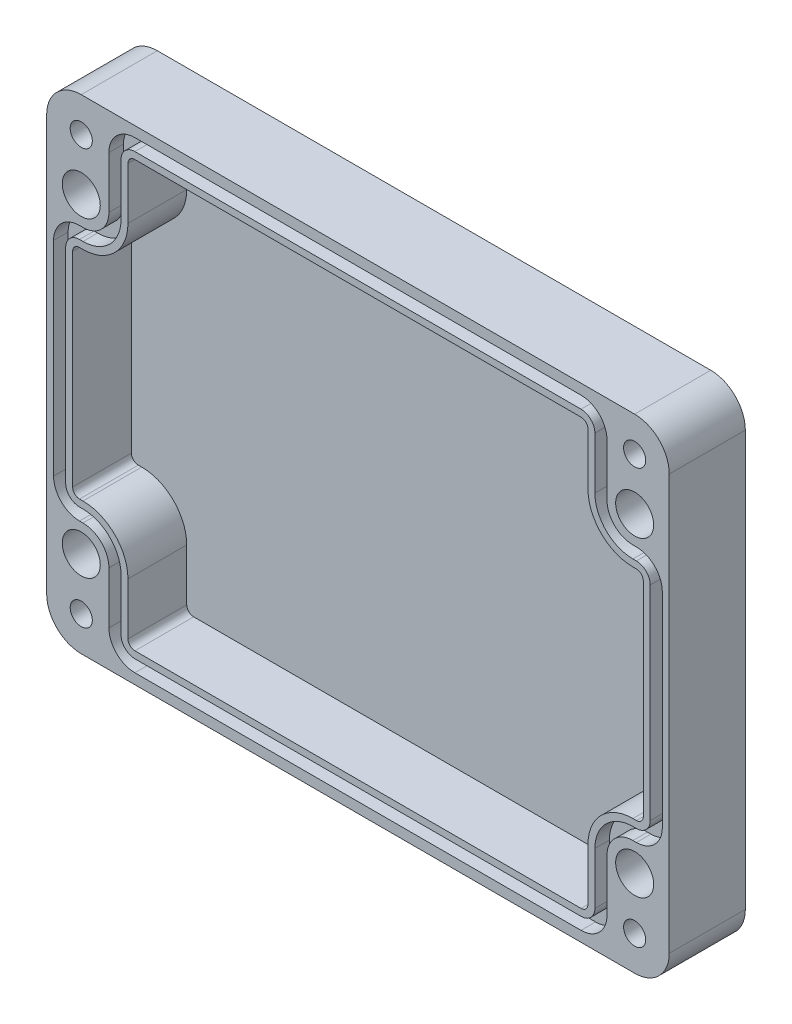
from build123d import *

# Parameters (mm, degrees)
SKETCH1_W                  = 180
SKETCH1_H                  = 140
BOSS_EXTRUDE1_DEPTH        = 22
CUT_EXTRUDE1_DEPTH         = 17
FILLET1_R                  = 2
FILLET2_R                  = 13
CUT_EXTRUDE2_DEPTH         = 4.2
FILLET3_R                  = 10
F_11_0_11_DIAMETER_HOLE1_D = 11
M6_CLEARANCE_HOLE1_D       = 6.4
SKETCH11_R                 = 5.5
CUT_EXTRUDE6_DEPTH         = 7


with BuildPart() as part:
    # Sketch1 → Boss-Extrude1 (new body)
    with BuildSketch(Plane.XY):
        Rectangle(SKETCH1_W, SKETCH1_H)
    extrude(amount=BOSS_EXTRUDE1_DEPTH)

    # Sketch2 → Cut-Extrude1 (cut)
    with BuildSketch(Plane.XY.offset(22)):
        Polygon((-66.5, 61.5), (66.5, 61.5), (66.5, 31.5), (82.5, 31.5), (82.5, -31.5), (66.5, -31.5), (66.5, -61.5), (-66.5, -61.5), (-66.5, -31.5), (-82.5, -31.5), (-82.5, 31.5), (-66.5, 31.5), align=None)
    extrude(amount=-CUT_EXTRUDE1_DEPTH, mode=Mode.SUBTRACT)

    # Fillet1
    fillet1_edges = [part.edges().sort_by_distance(p)[0] for p in [
        (-66.5, 61.5, 13.5),
        (66.5, 61.5, 13.5),
        (82.5, 31.5, 13.5),
        (82.5, -31.5, 13.5),
        (66.5, -61.5, 13.5),
        (-66.5, -61.5, 13.5),
        (-82.5, -31.5, 13.5),
        (-82.5, 31.5, 13.5),
    ]]
    fillet(fillet1_edges, radius=FILLET1_R)

    # Fillet2
    fillet2_edges = [part.edges().sort_by_distance(p)[0] for p in [
        (-66.5, 31.5, 13.5),
        (66.5, 31.5, 13.5),
        (66.5, -31.5, 13.5),
        (-66.5, -31.5, 13.5),
    ]]
    fillet(fillet2_edges, radius=FILLET2_R)

    # Sketch3 → Cut-Extrude2 (cut)
    with BuildSketch(Plane.XY.offset(22)):
        with BuildLine():
            Line((-72, 59.5), (-72, 44.5))
            ThreePointArc((-72, 44.5), (-74.196699141, 39.196699141), (-79.5, 37))
            Line((-79.5, 37), (-80.5, 37))
            ThreePointArc((-80.5, 37), (-85.803300859, 34.803300859), (-88, 29.5))
            Line((-88, 29.5), (-88, -29.5))
            ThreePointArc((-88, -29.5), (-85.803300859, -34.803300859), (-80.5, -37))
            Line((-80.5, -37), (-79.5, -37))
            ThreePointArc((-79.5, -37), (-74.196699141, -39.196699141), (-72, -44.5))
            Line((-72, -44.5), (-72, -59.5))
            ThreePointArc((-72, -59.5), (-69.803300859, -64.803300859), (-64.5, -67))
            Line((-64.5, -67), (64.5, -67))
            ThreePointArc((64.5, -67), (69.803300859, -64.803300859), (72, -59.5))
            Line((72, -59.5), (72, -44.5))
            ThreePointArc((72, -44.5), (74.196699141, -39.196699141), (79.5, -37))
            Line((79.5, -37), (80.5, -37))
            ThreePointArc((80.5, -37), (85.803300859, -34.803300859), (88, -29.5))
            Line((88, -29.5), (88, 29.5))
            ThreePointArc((88, 29.5), (85.803300859, 34.803300859), (80.5, 37))
            Line((80.5, 37), (79.5, 37))
            ThreePointArc((79.5, 37), (74.196699141, 39.196699141), (72, 44.5))
            Line((72, 44.5), (72, 59.5))
            ThreePointArc((72, 59.5), (69.803300859, 64.803300859), (64.5, 67))
            Line((64.5, 67), (-64.5, 67))
            ThreePointArc((-64.5, 67), (-69.803300859, 64.803300859), (-72, 59.5))
        make_face()
        with BuildLine():
            Line((-80.5, -33.5), (-79.5, -33.5))
            ThreePointArc((-79.5, -33.5), (-71.721825407, -36.721825407), (-68.5, -44.5))
            Line((-68.5, -44.5), (-68.5, -59.5))
            ThreePointArc((-68.5, -59.5), (-67.328427125, -62.328427125), (-64.5, -63.5))
            Line((-64.5, -63.5), (64.5, -63.5))
            ThreePointArc((64.5, -63.5), (67.328427125, -62.328427125), (68.5, -59.5))
            Line((68.5, -59.5), (68.5, -44.5))
            ThreePointArc((68.5, -44.5), (71.721825407, -36.721825407), (79.5, -33.5))
            Line((79.5, -33.5), (80.5, -33.5))
            ThreePointArc((80.5, -33.5), (83.328427125, -32.328427125), (84.5, -29.5))
            Line((84.5, -29.5), (84.5, 29.5))
            ThreePointArc((84.5, 29.5), (83.328427125, 32.328427125), (80.5, 33.5))
            Line((80.5, 33.5), (79.5, 33.5))
            ThreePointArc((79.5, 33.5), (71.721825407, 36.721825407), (68.5, 44.5))
            Line((68.5, 44.5), (68.5, 59.5))
            ThreePointArc((68.5, 59.5), (67.328427125, 62.328427125), (64.5, 63.5))
            Line((64.5, 63.5), (-64.5, 63.5))
            ThreePointArc((-64.5, 63.5), (-67.328427125, 62.328427125), (-68.5, 59.5))
            Line((-68.5, 59.5), (-68.5, 44.5))
            ThreePointArc((-68.5, 44.5), (-71.721825407, 36.721825407), (-79.5, 33.5))
            Line((-79.5, 33.5), (-80.5, 33.5))
            ThreePointArc((-80.5, 33.5), (-83.328427125, 32.328427125), (-84.5, 29.5))
            Line((-84.5, 29.5), (-84.5, -29.5))
            ThreePointArc((-84.5, -29.5), (-83.328427125, -32.328427125), (-80.5, -33.5))
        make_face(mode=Mode.SUBTRACT)
    extrude(amount=-CUT_EXTRUDE2_DEPTH, mode=Mode.SUBTRACT)

    # Fillet3
    fillet3_edges = [part.edges().sort_by_distance(p)[0] for p in [
        (-90, 70, 11),
        (90, 70, 11),
        (90, -70, 11),
        (-90, -70, 11),
    ]]
    fillet(fillet3_edges, radius=FILLET3_R)

    # Ø11.0 (11) Diameter Hole1 (through all)
    with Locations(Plane.XY.offset(22)):
        with Locations((-80, 45), (-80, -45), (80, -45), (80, 45)):
            Hole(F_11_0_11_DIAMETER_HOLE1_D / 2)

    # M6 Clearance Hole1 (through all)
    with Locations(Plane.XY.offset(22)):
        with Locations((-80, 60), (-80, -60), (80, -60), (80, 60)):
            Hole(M6_CLEARANCE_HOLE1_D / 2)

    # Sketch11 → Cut-Extrude6 (cut)
    with BuildSketch(Plane(origin=(0, 0, 0), x_dir=(-1, 0, 0), z_dir=(0, 0, -1))):
        with Locations((-80, 60)):
            Circle(SKETCH11_R)
        with Locations((-80, -60)):
            Circle(SKETCH11_R)
        with Locations((80, -60)):
            Circle(SKETCH11_R)
        with Locations((80, 60)):
            Circle(SKETCH11_R)
    extrude(amount=-CUT_EXTRUDE6_DEPTH, mode=Mode.SUBTRACT)


solid = part.part
